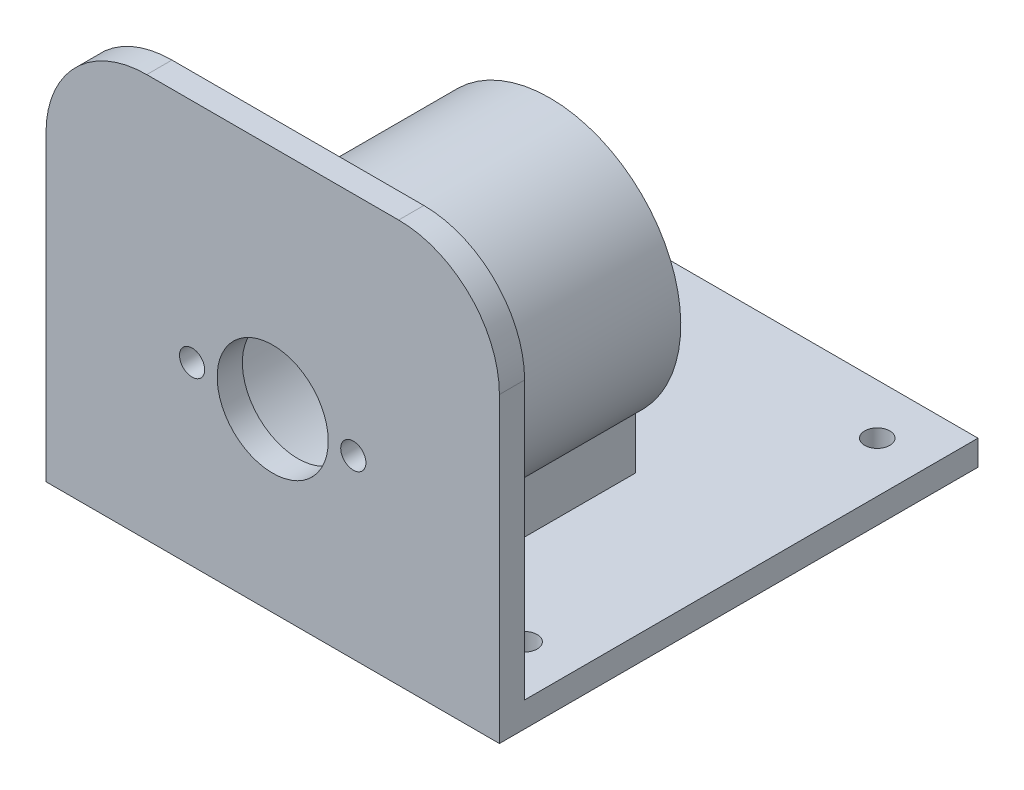
from build123d import *

# Parameters (mm, degrees)
CROQUIS1_R              = 11.025
SALIENTE_EXTRUIR1_DEPTH = 5
CROQUIS2_W              = 90
CROQUIS2_H              = 5
SALIENTE_EXTRUIR2_DEPTH = 90
CROQUIS3_R              = 21.5
SALIENTE_EXTRUIR3_DEPTH = 50
CROQUIS4_R              = 2.5
CORTAR_EXTRUIR1_DEPTH   = 70
CROQUIS5_R              = 2.5
CORTAR_EXTRUIR2_DEPTH   = 130.131715701


with BuildPart() as part:
    # Croquis1 → Saliente-Extruir1 (new body)
    with BuildSketch(Plane.XY):
        with BuildLine():
            Line((45, -2.305306559), (45, -35))
            Line((45, -35), (-45, -35))
            Line((-45, -35), (-45, 25))
            ThreePointArc((-45, 25), (-39.142135624, 39.142135624), (-25, 45))
            Line((-25, 45), (25, 45))
            ThreePointArc((25, 45), (39.142135624, 39.142135624), (45, 25))
            Line((45, 25), (45, -2.305306559))
        make_face()
        Circle(CROQUIS1_R, mode=Mode.SUBTRACT)
    extrude(amount=-SALIENTE_EXTRUIR1_DEPTH)

    # Croquis2 → Saliente-Extruir2 (add)
    with BuildSketch(Plane(origin=(0, 0, -5), x_dir=(-1, 0, 0), z_dir=(0, 0, -1))):
        with Locations((0, -32.5)):
            Rectangle(CROQUIS2_W, CROQUIS2_H)
    extrude(amount=SALIENTE_EXTRUIR2_DEPTH)

    # Croquis3 → Saliente-Extruir3 (add)
    with BuildSketch(Plane(origin=(0, 0, -5), x_dir=(-1, 0, 0), z_dir=(0, 0, -1))):
        with BuildLine():
            Line((17, -30), (17, -19.672315573))
            ThreePointArc((17, -19.672315573), (0, 26), (-17, -19.672315573))
            Line((-17, -19.672315573), (-17, -30))
            Line((-17, -30), (17, -30))
        make_face()
        Circle(CROQUIS3_R, mode=Mode.SUBTRACT)
    extrude(amount=SALIENTE_EXTRUIR3_DEPTH)

    # Croquis4 → Cortar-Extruir1 (cut)
    with BuildSketch(Plane.XY):
        with Locations((-16, 0)):
            Circle(CROQUIS4_R)
        with Locations((16, 0)):
            Circle(CROQUIS4_R)
    extrude(amount=-CORTAR_EXTRUIR1_DEPTH, mode=Mode.SUBTRACT)

    # Croquis5 → Cortar-Extruir2 (cut, through all)
    with BuildSketch(Plane(origin=(0, -30, 0), x_dir=(1, 0, 0), z_dir=(0, 1, 0))):
        with Locations(Location((-35, 85, 0), (0, 0, 180))):
            Circle(CROQUIS5_R)
        with Locations((35, 85)):
            Circle(CROQUIS5_R)
        with Locations(Location((35, 15, 0), (0, 0, 180))):
            Circle(CROQUIS5_R)
        with Locations((-35, 15)):
            Circle(CROQUIS5_R)
    extrude(amount=-CORTAR_EXTRUIR2_DEPTH, mode=Mode.SUBTRACT)


solid = part.part
